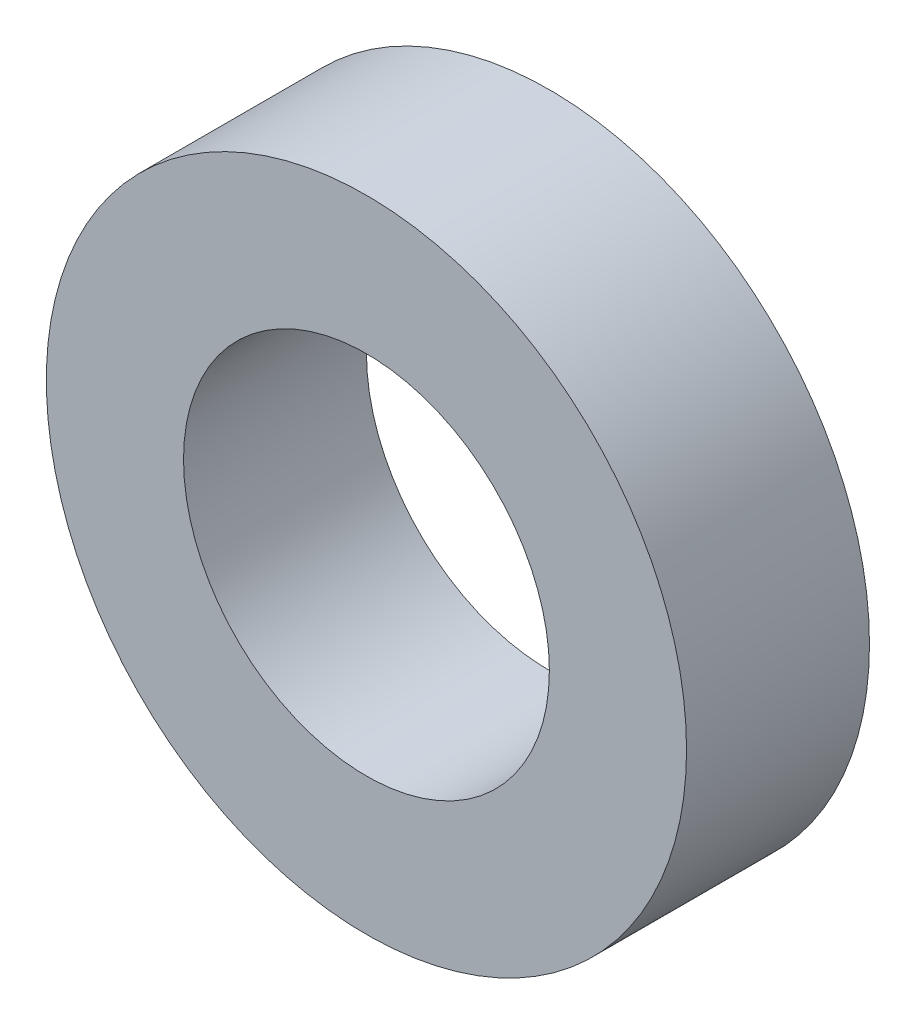
from build123d import *

# Parameters (mm, degrees)
SKETCH_1_R      = 7
SKETCH_1_R_2    = 4
EXTRUDE_1_DEPTH = 4


with BuildPart() as part:
    # 草图1 → 凸台-拉伸1 (new body)
    with BuildSketch(Plane.XY):
        Circle(SKETCH_1_R)
        Circle(SKETCH_1_R_2, mode=Mode.SUBTRACT)
    extrude(amount=EXTRUDE_1_DEPTH)


solid = part.part
